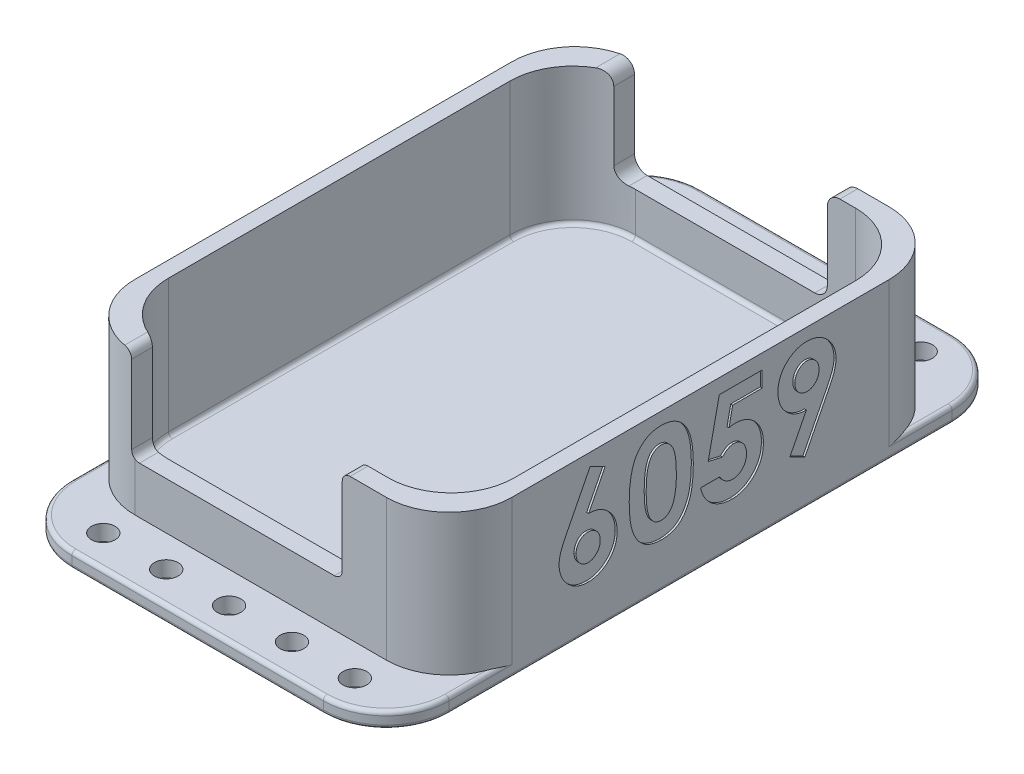
from build123d import *

# Parameters (mm, degrees)
SKETCH1_W                      = 76.2
SKETCH1_H                      = 101.6
BOSS_EXTRUDE1_DEPTH            = 0.79375
SKETCH2_W                      = 76.2
SKETCH2_H                      = 101.6
SKETCH2_W_2                    = 69.85
SKETCH2_H_2                    = 94.361
BOSS_EXTRUDE2_DEPTH            = 27.178
FILLET1_R                      = 12.7
SKETCH3_W                      = 42.545
SKETCH3_H                      = 18.44675
CUT_EXTRUDE1_DEPTH             = 113.056185898
BOSS_EXTRUDE3_START            = 0.508
BOSS_EXTRUDE3_DEPTH            = 0.508
FILLET2_R                      = 1.5875
SKETCH5_W                      = 76.2
SKETCH5_H                      = 127
BOSS_EXTRUDE4_DEPTH            = 3.175
FILLET3_R                      = 12.7
F_3_16_0_1875_DIAMETER_HOLE1_D = 4.7625
FILLET4_R                      = 0.79375
FILLET5_R                      = 0.79375
CUT_EXTRUDE2_DEPTH             = 0.396875
CUT_EXTRUDE3_DEPTH             = 0.396875
FILLET7_R                      = 0.79375
FILLET8_R                      = 2.54


with BuildPart() as part:
    # Sketch1 → Boss-Extrude1 (new body)
    with BuildSketch(Plane(origin=(0, 0, 0), x_dir=(1, 0, 0), z_dir=(0, 1, 0))):
        Rectangle(SKETCH1_W, SKETCH1_H)
    extrude(amount=BOSS_EXTRUDE1_DEPTH)

    # Sketch2 → Boss-Extrude2 (add)
    with BuildSketch(Plane(origin=(0, 0.79375, 0), x_dir=(1, 0, 0), z_dir=(0, 1, 0))):
        Rectangle(SKETCH2_W, SKETCH2_H)
        Rectangle(SKETCH2_W_2, SKETCH2_H_2, mode=Mode.SUBTRACT)
    extrude(amount=BOSS_EXTRUDE2_DEPTH)

    # Fillet1
    fillet1_edges = [part.edges().sort_by_distance(p)[0] for p in [
        (34.925, 14.38275, -47.1805),
        (-34.925, 14.38275, -47.1805),
        (-34.925, 14.38275, 47.1805),
        (34.925, 14.38275, 47.1805),
        (38.1, 13.985875, 50.8),
        (-38.1, 13.985875, 50.8),
        (-38.1, 13.985875, -50.8),
        (38.1, 13.985875, -50.8),
    ]]
    fillet(fillet1_edges, radius=FILLET1_R)

    # Sketch3 → Cut-Extrude1 (cut, through all)
    with BuildSketch(Plane.XY.offset(50.8)):
        with Locations((-4.7625, 18.748375)):
            Rectangle(SKETCH3_W, SKETCH3_H)
    extrude(amount=-CUT_EXTRUDE1_DEPTH, mode=Mode.SUBTRACT)

    # Sketch4 → Boss-Extrude3 (add)
    with BuildSketch(Plane(origin=(0, 27.97175, 0), x_dir=(1, 0, 0), z_dir=(0, 1, 0)).offset(BOSS_EXTRUDE3_START)):
        with BuildLine():
            Line((16.51, -47.1805), (16.51, -50.8))
            Line((16.51, -50.8), (25.4, -50.8))
            ThreePointArc((25.4, -50.8), (34.380256121, -47.080256121), (38.1, -38.1))
            Line((38.1, -38.1), (38.1, 38.1))
            ThreePointArc((38.1, 38.1), (34.380256121, 47.080256121), (25.4, 50.8))
            Line((25.4, 50.8), (16.51, 50.8))
            Line((16.51, 50.8), (16.51, 47.1805))
            Line((16.51, 47.1805), (22.225, 47.1805))
            ThreePointArc((22.225, 47.1805), (31.205256121, 43.460756121), (34.925, 34.4805))
            Line((34.925, 34.4805), (34.925, -34.4805))
            ThreePointArc((34.925, -34.4805), (31.205256121, -43.460756121), (22.225, -47.1805))
            Line((22.225, -47.1805), (16.51, -47.1805))
        make_face()
        with BuildLine():
            ThreePointArc((-38.1, -38.1), (-34.602024234, -46.852870958), (-26.035, -50.784115066))
            Line((-26.035, -50.784115066), (-26.035, -46.595527858))
            ThreePointArc((-26.035, -46.595527858), (-32.46406734, -41.993921325), (-34.925, -34.4805))
            Line((-34.925, -34.4805), (-34.925, 34.4805))
            ThreePointArc((-34.925, 34.4805), (-32.46406734, 41.993921325), (-26.035, 46.595527858))
            Line((-26.035, 46.595527858), (-26.035, 50.784115066))
            ThreePointArc((-26.035, 50.784115066), (-34.602024234, 46.852870958), (-38.1, 38.1))
            Line((-38.1, 38.1), (-38.1, -38.1))
        make_face()
    extrude(amount=-BOSS_EXTRUDE3_DEPTH)

    # Fillet2
    fillet2_edges = [part.edges().sort_by_distance(p)[0] for p in [
        (16.51, 28.47975, 48.99025),
        (16.51, 9.525, 48.99025),
        (-26.035, 9.525, 48.689821462),
        (-26.035, 28.47975, 48.689821462),
    ]]
    fillet(fillet2_edges, radius=FILLET2_R)

    # Sketch5 → Boss-Extrude4 (add)
    with BuildSketch(Plane.XZ):
        Rectangle(SKETCH5_W, SKETCH5_H)
    extrude(amount=BOSS_EXTRUDE4_DEPTH)

    # Fillet3
    fillet3_edges = [part.edges().sort_by_distance(p)[0] for p in [
        (-38.1, -1.5875, 63.5),
        (-38.1, -1.5875, -63.5),
        (38.1, -1.5875, -63.5),
        (38.1, -1.5875, 63.5),
    ]]
    fillet(fillet3_edges, radius=FILLET3_R)

    # 3/16 (0.1875) Diameter Hole1 (through all)
    with Locations(Plane(origin=(-25.4, 0, 57.15), x_dir=(0, 0, 1), z_dir=(0, 1, 0))):
        with Locations((0, 0), (0, 12.7), (0, 25.4), (0, 38.1), (0, 50.8), (-114.3, 50.8), (-114.3, 38.1), (-114.3, 25.4), (-114.3, 12.7), (-114.3, 0)):
            Hole(F_3_16_0_1875_DIAMETER_HOLE1_D / 2)

    # Fillet4
    fillet4_edges = [part.edges().sort_by_distance(p)[0] for p in [
        (-38.1, 0, -44.45),
        (0, 0, -63.5),
        (38.1, 0, -44.45),
        (34.380256121, 0, -59.780256121),
        (-34.380256121, 0, -59.780256121),
    ]]
    fillet(fillet4_edges, radius=FILLET4_R)

    # Fillet5
    fillet5_edges = [part.edges().sort_by_distance(p)[0] for p in [
        (38.1, 0, 44.45),
        (0, -3.175, -63.5),
        (-38.1, -3.175, 0),
        (-38.1, 0, 44.45),
        (38.1, -3.175, 0),
        (0, -3.175, 63.5),
        (-34.380256121, -3.175, 59.780256121),
        (34.380256121, -3.175, 59.780256121),
        (34.380256121, -3.175, -59.780256121),
        (-34.380256121, -3.175, -59.780256121),
        (0, 0, 63.5),
        (-34.380256121, 0, 59.780256121),
        (34.380256121, 0, 59.780256121),
    ]]
    fillet(fillet5_edges, radius=FILLET5_R)

    # Sketch9 → Cut-Extrude2 (cut)
    # profile 1 of 4: a face of its own
    with BuildSketch(Plane.ZY.offset(38.1)):
        with BuildLine():
            Line((-21.67815406, 26.514268643), (-18.651982185, 24.980194124))
            Line((-18.651982185, 24.980194124), (-21.971994204, 18.454653258))
            add(Edge.make_bspline(
                [(-21.971994204, 18.454653258), (-21.775851009, 18.449575012), (-21.389514821, 18.439572574), (-20.821099511, 18.358731191), (-20.277683894, 18.218975825), (-19.753788733, 18.033730465), (-19.255818152, 17.784944107), (-18.775752056, 17.488999756), (-18.326009998, 17.128063787), (-17.896279778, 16.728165883), (-17.505528296, 16.285136477), (-17.166091552, 15.809087307), (-16.870278422, 15.311600707), (-16.640325199, 14.781546695), (-16.454837273, 14.22771152), (-16.320999571, 13.647881262), (-16.244641417, 13.040376863), (-16.234114172, 12.627671605), (-16.228755021, 12.417573932)],
                knots=[0, 0, 0, 0, 1.013260694, 1.995783107, 2.958651975, 3.908806537, 4.861209129, 5.829647963, 6.817170299, 7.835534541, 8.860094905, 9.863329007, 10.853101798, 11.844815043, 12.84250023, 13.867713965, 14.914507806, 16, 16, 16, 16], degree=3))
            add(Edge.make_bspline(
                [(-16.228755021, 12.417573932), (-16.233776989, 12.215052519), (-16.243703266, 11.81475453), (-16.325757085, 11.226818591), (-16.458360367, 10.662728441), (-16.647877085, 10.123610637), (-16.888768161, 9.606829956), (-17.183361629, 9.11268965), (-17.534100571, 8.644882268), (-17.931922863, 8.205893512), (-18.366811257, 7.805752016), (-18.82520731, 7.450082966), (-19.310995415, 7.156286837), (-19.814993607, 6.908169119), (-20.346480801, 6.723019551), (-20.897503265, 6.583263701), (-21.472239563, 6.502618509), (-21.862355836, 6.492477285), (-22.059764637, 6.487345566)],
                knots=[0, 0, 0, 0, 1.049934834, 2.075270938, 3.072134561, 4.05064612, 5.033440221, 6.024524368, 7.028587226, 8.060776465, 9.092543989, 10.090062252, 11.064205434, 12.031961459, 12.998029633, 13.977230324, 14.976426867, 16, 16, 16, 16], degree=3))
            add(Edge.make_bspline(
                [(-22.059764637, 6.487345566), (-22.266194253, 6.491556895), (-22.672110161, 6.499837904), (-23.266066723, 6.592563379), (-23.835722186, 6.732148656), (-24.377874992, 6.931452715), (-24.895896629, 7.185228629), (-25.383688327, 7.499250799), (-25.845359054, 7.8700564), (-26.275986725, 8.289302893), (-26.663950165, 8.748530063), (-27.009981128, 9.225327428), (-27.30272377, 9.720443189), (-27.539692114, 10.233347973), (-27.724580312, 10.762407385), (-27.853224789, 11.308625538), (-27.937048537, 11.870553587), (-27.94687496, 12.25190976), (-27.951831945, 12.444286672)],
                knots=[0, 0, 0, 0, 1.063775006, 2.091769615, 3.092589432, 4.084662827, 5.064601646, 6.061867366, 7.070035304, 8.113879863, 9.156342271, 10.166834137, 11.149076039, 12.117706134, 13.076241869, 14.034148791, 15.008317125, 16, 16, 16, 16], degree=3))
            add(Edge.make_bspline(
                [(-27.951831945, 12.444286672), (-27.949212771, 12.593260086), (-27.943959845, 12.892036161), (-27.891171076, 13.339437097), (-27.810913605, 13.788012419), (-27.717884687, 14.166534479), (-27.622092907, 14.486614495), (-27.525677744, 14.757489563), (-27.406192394, 15.058101659), (-27.269602939, 15.389218425), (-27.111614139, 15.750441528), (-26.933051298, 16.140786368), (-26.733469876, 16.563208929), (-26.591140833, 16.853347819), (-26.516976175, 17.004533066)],
                knots=[0, 0, 0, 0, 1.110454016, 2.227089276, 3.35462975, 4.507227546, 5.131400587, 5.845402449, 6.650387134, 7.543487832, 8.516250726, 9.590168902, 10.744287919, 12, 12, 12, 12], degree=3))
            Line((-26.516976175, 17.004533066), (-21.67815406, 26.514268643))
        make_face()
        with BuildLine():
            add(Edge.make_bspline(
                [(-22.136086752, 15.279653258), (-22.300151851, 15.272127939), (-22.621205714, 15.257401877), (-23.077696292, 15.103183383), (-23.493912129, 14.86125295), (-23.854693164, 14.524318033), (-24.156453303, 14.121667577), (-24.37819724, 13.662390949), (-24.511588543, 13.152617068), (-24.525447045, 12.79619167), (-24.532601175, 12.612195326)],
                knots=[0, 0, 0, 0, 0.981744412, 1.921144944, 2.858899012, 3.85339082, 4.86292663, 5.863643845, 6.897155691, 8, 8, 8, 8], degree=3))
            add(Edge.make_bspline(
                [(-24.532601175, 12.612195326), (-24.524130461, 12.42813771), (-24.507654356, 12.070133345), (-24.369247366, 11.555505507), (-24.142632178, 11.085799239), (-23.824818827, 10.67781279), (-23.451710521, 10.33915245), (-23.037977664, 10.088696935), (-22.590521469, 9.934833894), (-22.281005091, 9.916060561), (-22.124638435, 9.906576335)],
                knots=[0, 0, 0, 0, 1.098279937, 2.136227893, 3.159405121, 4.194678092, 5.206500211, 6.154139736, 7.067477469, 8, 8, 8, 8], degree=3))
            add(Edge.make_bspline(
                [(-22.124638435, 9.906576335), (-21.959497573, 9.916229482), (-21.635627661, 9.935160979), (-21.168424071, 10.082549745), (-20.741630789, 10.328809309), (-20.364262972, 10.666385399), (-20.040111188, 11.069716174), (-19.815830896, 11.542181431), (-19.671025289, 12.060523669), (-19.655837812, 12.4241818), (-19.647985791, 12.612195326)],
                knots=[0, 0, 0, 0, 0.96921794, 1.900804717, 2.848419905, 3.844199796, 4.861108892, 5.867439427, 6.897452859, 8, 8, 8, 8], degree=3))
            add(Edge.make_bspline(
                [(-19.647985791, 12.612195326), (-19.656930677, 12.796084237), (-19.674253493, 13.152206585), (-19.804368371, 13.664368639), (-20.0366797, 14.121875045), (-20.345267406, 14.525980111), (-20.718464609, 14.862764787), (-21.151338252, 15.105091322), (-21.628682081, 15.257128652), (-21.964485864, 15.272035586), (-22.136086752, 15.279653258)],
                knots=[0, 0, 0, 0, 1.083229974, 2.097801324, 3.086792542, 4.086858909, 5.079819718, 6.026392613, 6.991456328, 8, 8, 8, 8], degree=3))
        make_face(mode=Mode.SUBTRACT)
    # profile 2 of 4: a face of its own
    with BuildSketch(Plane.ZY.offset(38.1)):
        with BuildLine():
            add(Edge.make_bspline(
                [(-7.371573531, 26.514268643), (-7.20606857, 26.511811675), (-6.880641598, 26.50698062), (-6.401348924, 26.454656358), (-5.939657563, 26.375608991), (-5.493761321, 26.265365478), (-5.066869805, 26.119462115), (-4.655876008, 25.944818291), (-4.265671948, 25.732273577), (-3.891281276, 25.492193407), (-3.532848207, 25.22038862), (-3.198987429, 24.910517128), (-2.883601935, 24.569709088), (-2.59351866, 24.192812094), (-2.322313621, 23.783254422), (-2.070877952, 23.340971131), (-1.841136456, 22.86379754), (-1.630514278, 22.350872552), (-1.442175262, 21.794507641), (-1.283537542, 21.188321061), (-1.147479152, 20.53217438), (-1.032636271, 19.824434349), (-0.945833615, 19.064160211), (-0.887326877, 18.251857056), (-0.847176784, 17.389090884), (-0.843900014, 16.797240379), (-0.84221656, 16.493174893)],
                knots=[0, 0, 0, 0, 0.879237366, 1.728815576, 2.559023295, 3.367336655, 4.166867292, 4.954216142, 5.737608147, 6.525189134, 7.316157332, 8.124696809, 8.942788509, 9.781158001, 10.649253743, 11.551476218, 12.482711956, 13.461909668, 14.496590415, 15.601789533, 16.789733467, 18.056700938, 19.410929216, 20.8549011, 22.384193279, 24, 24, 24, 24], degree=3))
            add(Edge.make_bspline(
                [(-0.84221656, 16.493174893), (-0.844035918, 16.185305206), (-0.847570899, 15.587119928), (-0.885657826, 14.716462458), (-0.951245313, 13.898261494), (-1.035779201, 13.132601685), (-1.151567503, 12.419887362), (-1.2871717, 11.758273076), (-1.448313468, 11.147998645), (-1.642856311, 10.590439148), (-1.852203588, 10.07661335), (-2.082573526, 9.600370134), (-2.329950809, 9.160419569), (-2.588661349, 8.750124403), (-2.872888608, 8.381579928), (-3.168798445, 8.042253705), (-3.489275303, 7.745071106), (-3.820825866, 7.474716672), (-4.175596174, 7.241076187), (-4.549927572, 7.03673807), (-4.950493741, 6.870995589), (-5.369993039, 6.726841631), (-5.815575919, 6.623354643), (-6.280162128, 6.541241119), (-6.768996751, 6.495860149), (-7.101815052, 6.490230341), (-7.272354781, 6.487345566)],
                knots=[0, 0, 0, 0, 1.643780988, 3.193836972, 4.651895693, 6.025988579, 7.305620092, 8.505800249, 9.631074763, 10.672816429, 11.65661981, 12.592235626, 13.49536222, 14.350718032, 15.179365177, 15.97804903, 16.751647189, 17.51006938, 18.259804725, 19.016521909, 19.783502495, 20.571750527, 21.382245291, 22.22305063, 23.089471752, 24, 24, 24, 24], degree=3))
            add(Edge.make_bspline(
                [(-7.272354781, 6.487345566), (-7.442889907, 6.490285987), (-7.776965711, 6.496046227), (-8.267122192, 6.540903692), (-8.734170475, 6.623687286), (-9.183278631, 6.727636127), (-9.611320938, 6.870676634), (-10.020349846, 7.041378012), (-10.407220277, 7.24444116), (-10.773003415, 7.478626006), (-11.116450371, 7.747171564), (-11.442898309, 8.047205437), (-11.751625108, 8.377967119), (-12.037934266, 8.743161412), (-12.306514701, 9.137913735), (-12.554565542, 9.566731968), (-12.781937718, 10.028991761), (-12.995743472, 10.525337456), (-13.181513608, 11.066454808), (-13.346840404, 11.657175926), (-13.482271766, 12.302424957), (-13.59119473, 13.001994609), (-13.678158762, 13.754402812), (-13.742850006, 14.560012733), (-13.781148489, 15.419199604), (-13.784646398, 16.009761539), (-13.786447329, 16.313817922)],
                knots=[0, 0, 0, 0, 0.917216111, 1.796812873, 2.643793957, 3.46689424, 4.273913431, 5.068098542, 5.848489301, 6.620921603, 7.401012384, 8.190319798, 9.003608147, 9.831726257, 10.68377682, 11.569763213, 12.493818149, 13.453288342, 14.474581811, 15.568529029, 16.750744269, 18.018426408, 19.375425659, 20.823733699, 22.36466933, 24, 24, 24, 24], degree=3))
            add(Edge.make_bspline(
                [(-13.786447329, 16.313817922), (-13.78318511, 16.73628033), (-13.776890616, 17.551426989), (-13.697122168, 18.729076907), (-13.580042319, 19.817610258), (-13.408079753, 20.815206193), (-13.195450419, 21.725559517), (-12.923167485, 22.542673299), (-12.613193171, 23.27785414), (-12.349055233, 23.713379697), (-12.221843964, 23.923132826)],
                knots=[0, 0, 0, 0, 1.288568992, 2.486310467, 3.599230591, 4.627010532, 5.572937695, 6.447898582, 7.252493626, 8, 8, 8, 8], degree=3))
            add(Edge.make_bspline(
                [(-12.221843964, 23.923132826), (-12.073928759, 24.129194234), (-11.784725386, 24.532084893), (-11.279045206, 25.061005017), (-10.73575769, 25.513363407), (-10.143704024, 25.878922788), (-9.512247783, 26.167202945), (-8.835967593, 26.370811974), (-8.117360844, 26.489444081), (-7.623881603, 26.50587022), (-7.371573531, 26.514268643)],
                knots=[0, 0, 0, 0, 1.058512271, 2.069600068, 3.047294572, 4.004278952, 4.967380941, 5.939006123, 6.946246673, 8, 8, 8, 8], degree=3))
        make_face()
        with BuildLine():
            add(Edge.make_bspline(
                [(-7.287619204, 23.095037874), (-7.437237061, 23.087946285), (-7.730567483, 23.074043006), (-8.1562039, 22.956023785), (-8.557552467, 22.773736734), (-8.862847602, 22.554382769), (-9.091357974, 22.344105688), (-9.25101981, 22.153811768), (-9.404988486, 21.941457469), (-9.540981374, 21.697460331), (-9.66939416, 21.430587462), (-9.794892158, 21.139627417), (-9.897767563, 20.817433588), (-9.99883992, 20.469492979), (-10.087388736, 20.086185955), (-10.161573232, 19.664379405), (-10.227850558, 19.201330282), (-10.274079783, 18.696735287), (-10.317179294, 18.151122352), (-10.348075065, 17.563276063), (-10.360991811, 16.933355009), (-10.365097651, 16.499537726), (-10.36721656, 16.275656864)],
                knots=[0, 0, 0, 0, 1.076674018, 2.110852608, 3.161083442, 4.239746716, 4.804137807, 5.395870207, 6.026861976, 6.692161227, 7.405688833, 8.16177676, 8.973626916, 9.841385931, 10.773283133, 11.807421078, 12.927755683, 14.143907515, 15.458935494, 16.872852025, 18.386167141, 20, 20, 20, 20], degree=3))
            add(Edge.make_bspline(
                [(-10.36721656, 16.275656864), (-10.363729094, 15.985608384), (-10.357041618, 15.429418919), (-10.322015749, 14.629599101), (-10.2518093, 13.901698664), (-10.164486653, 13.240784356), (-10.041838429, 12.651142384), (-9.900723708, 12.127194187), (-9.726459575, 11.675618833), (-9.525063792, 11.289885528), (-9.302008888, 10.961743006), (-9.059872977, 10.682820384), (-8.806899919, 10.441286553), (-8.535193604, 10.245091599), (-8.24540224, 10.09473683), (-7.939945054, 9.986588501), (-7.61862793, 9.920386406), (-7.398593276, 9.911206303), (-7.287619204, 9.906576335)],
                knots=[0, 0, 0, 0, 1.771748488, 3.397459088, 4.888034009, 6.237357457, 7.467047327, 8.564189669, 9.548206622, 10.417051504, 11.216568818, 11.965764335, 12.669334354, 13.348544111, 14.005342236, 14.656555988, 15.322436492, 16, 16, 16, 16], degree=3))
            add(Edge.make_bspline(
                [(-7.287619204, 9.906576335), (-7.180453411, 9.909744503), (-6.970636113, 9.915947382), (-6.664675502, 9.979619099), (-6.375337408, 10.083135482), (-6.103495433, 10.229566673), (-5.848177236, 10.415776336), (-5.610630654, 10.642582757), (-5.392647217, 10.912246667), (-5.265649076, 11.112377169), (-5.200209348, 11.215500614)],
                knots=[0, 0, 0, 0, 0.992283464, 1.942767638, 2.88273346, 3.832339453, 4.79467288, 5.803907806, 6.868395428, 8, 8, 8, 8], degree=3))
            add(Edge.make_bspline(
                [(-5.200209348, 11.215500614), (-5.12316509, 11.356415506), (-4.961609528, 11.651902605), (-4.774657152, 12.150526068), (-4.617291062, 12.712890922), (-4.48184837, 13.340747302), (-4.389213831, 14.03657155), (-4.309437079, 14.795951384), (-4.270958769, 15.622710733), (-4.264700062, 16.195492593), (-4.261447329, 16.493174893)],
                knots=[0, 0, 0, 0, 0.710965849, 1.490837728, 2.352621235, 3.297892224, 4.334225155, 5.461620853, 6.680770821, 8, 8, 8, 8], degree=3))
            add(Edge.make_bspline(
                [(-4.261447329, 16.493174893), (-4.26270379, 16.793441219), (-4.265122261, 17.371402639), (-4.309494212, 18.201134246), (-4.371285544, 18.958956364), (-4.461668425, 19.643177082), (-4.577962429, 20.25545739), (-4.721295227, 20.795757262), (-4.890273935, 21.265141525), (-5.090662544, 21.663142139), (-5.312605379, 22.001388063), (-5.548204474, 22.29157683), (-5.798456037, 22.539332678), (-6.062941567, 22.745587956), (-6.347782673, 22.903182457), (-6.647538519, 23.014457212), (-6.962823627, 23.081774707), (-7.177892706, 23.090557145), (-7.287619204, 23.095037874)],
                knots=[0, 0, 0, 0, 1.793836731, 3.452829483, 4.963243077, 6.335886805, 7.574563692, 8.684454726, 9.672768357, 10.54971625, 11.340229787, 12.085688095, 12.778991901, 13.440269426, 14.083255152, 14.715733572, 15.344777694, 16, 16, 16, 16], degree=3))
        make_face(mode=Mode.SUBTRACT)
    # profile 3 of 4: a face of its own
    with BuildSketch(Plane.ZY.offset(38.1)):
        with BuildLine():
            Line((4.404928873, 26.025807105), (13.078937286, 26.025807105))
            Line((13.078937286, 26.025807105), (13.078937286, 22.850807105))
            Line((13.078937286, 22.850807105), (7.114363969, 22.850807105))
            Line((7.114363969, 22.850807105), (6.370223344, 19.248403258))
            add(Edge.make_bspline(
                [(6.370223344, 19.248403258), (6.471623156, 19.276644386), (6.67160442, 19.332341693), (6.972876441, 19.388199044), (7.264851015, 19.424404004), (7.456442949, 19.429233263), (7.549400027, 19.431576335)],
                knots=[0, 0, 0, 0, 1.05461699, 2.079921384, 3.068411212, 4, 4, 4, 4], degree=3))
            add(Edge.make_bspline(
                [(7.549400027, 19.431576335), (7.751963237, 19.426934717), (8.151259947, 19.417785064), (8.735380365, 19.330925016), (9.294710172, 19.194123071), (9.827537757, 18.999015274), (10.333342618, 18.745077436), (10.812737891, 18.437883836), (11.266311953, 18.076894931), (11.686007419, 17.661884711), (12.071641145, 17.206194092), (12.406927675, 16.713316471), (12.693283295, 16.190279802), (12.921040655, 15.633832902), (13.10080618, 15.047470631), (13.230708763, 14.430817229), (13.30752665, 13.783141872), (13.317885071, 13.341279282), (13.323168055, 13.115921287)],
                knots=[0, 0, 0, 0, 1.01440847, 1.999622559, 2.951875003, 3.895578053, 4.836219714, 5.782137149, 6.743708247, 7.735272588, 8.734977101, 9.730283169, 10.717124674, 11.717316708, 12.737475749, 13.78628267, 14.87096371, 16, 16, 16, 16], degree=3))
            add(Edge.make_bspline(
                [(13.323168055, 13.115921287), (13.316712164, 12.888004957), (13.303972803, 12.438259415), (13.220860147, 11.776974382), (13.074164816, 11.143612607), (12.872664101, 10.536478596), (12.607199808, 9.96003464), (12.287942663, 9.408309208), (11.90949489, 8.885397582), (11.475570357, 8.396660242), (11.00383747, 7.94994493), (10.501553301, 7.556968615), (9.972246549, 7.226282229), (9.415904442, 6.959031722), (8.83571889, 6.747587879), (8.231513802, 6.593666854), (7.600352818, 6.505401698), (7.171876518, 6.493430415), (6.954087527, 6.487345566)],
                knots=[0, 0, 0, 0, 1.06808661, 2.107647099, 3.116961351, 4.110378221, 5.100014249, 6.085620622, 7.093190682, 8.119403071, 9.144090782, 10.133780668, 11.103064255, 12.062861538, 13.020824475, 13.992378307, 14.979551724, 16, 16, 16, 16], degree=3))
            add(Edge.make_bspline(
                [(6.954087527, 6.487345566), (6.759325315, 6.492323352), (6.375213475, 6.502140586), (5.809433598, 6.562482481), (5.263958967, 6.669167517), (4.741685459, 6.823568389), (4.237117881, 7.013600614), (3.756089179, 7.251271824), (3.295956018, 7.532056438), (2.858025001, 7.850830132), (2.449411887, 8.209916334), (2.076473133, 8.602998051), (1.736950922, 9.02512068), (1.438110497, 9.481491931), (1.180888632, 9.971437541), (0.952779035, 10.489183389), (0.766069045, 11.040136392), (0.671319103, 11.422087625), (0.623168055, 11.61619172)],
                knots=[0, 0, 0, 0, 1.054957082, 2.080596141, 3.077793124, 4.061112343, 5.027190972, 5.994718051, 6.962465889, 7.943658696, 8.924948258, 9.904494768, 10.875059, 11.855380583, 12.854004648, 13.869083016, 14.917087635, 16, 16, 16, 16], degree=3))
            Line((0.623168055, 11.61619172), (4.530860363, 11.61619172))
            add(Edge.make_bspline(
                [(4.530860363, 11.61619172), (4.602293073, 11.481685486), (4.741114392, 11.220287971), (5.005183232, 10.873243493), (5.300791534, 10.577298872), (5.625272749, 10.329562664), (5.980729315, 10.143962913), (6.352677047, 10.003212648), (6.745788568, 9.921878283), (7.01351487, 9.911710681), (7.148708921, 9.906576335)],
                knots=[0, 0, 0, 0, 1.104910296, 2.147267069, 3.153527244, 4.136738762, 5.099945312, 6.05603338, 7.018353, 8, 8, 8, 8], degree=3))
            add(Edge.make_bspline(
                [(7.148708921, 9.906576335), (7.24293736, 9.910121646), (7.428333403, 9.917097103), (7.701485155, 9.953999025), (7.962220503, 10.023890428), (8.212477951, 10.120673773), (8.452929756, 10.241373536), (8.680128957, 10.393749123), (8.89802841, 10.569139073), (9.103310803, 10.770399634), (9.289237481, 10.994758345), (9.45227484, 11.235847075), (9.598052722, 11.48830878), (9.706032628, 11.762144102), (9.79445904, 12.049176221), (9.859579827, 12.351570308), (9.898496842, 12.669679536), (9.902099516, 12.886843787), (9.903937286, 12.997622008)],
                knots=[0, 0, 0, 0, 0.978869489, 1.925942215, 2.855067702, 3.774946051, 4.70828698, 5.642468714, 6.60995405, 7.609372294, 8.622401667, 9.629904756, 10.629323, 11.642352373, 12.678539694, 13.745912462, 14.850161547, 16, 16, 16, 16], degree=3))
            add(Edge.make_bspline(
                [(9.903937286, 12.997622008), (9.901804342, 13.105828816), (9.897652514, 13.316455993), (9.863307766, 13.625732135), (9.801865672, 13.919179221), (9.718150292, 14.199044839), (9.610984612, 14.463629508), (9.480020986, 14.714508164), (9.324699927, 14.950412707), (9.144187546, 15.166540352), (8.951691001, 15.364778774), (8.744887858, 15.538156519), (8.525641301, 15.682048009), (8.300764149, 15.807669467), (8.061280114, 15.899094025), (7.812574231, 15.962054746), (7.554908047, 16.00825279), (7.379159534, 16.010967094), (7.289904834, 16.012345566)],
                knots=[0, 0, 0, 0, 1.166249705, 2.270133367, 3.348514167, 4.393962215, 5.415026464, 6.420877785, 7.440098956, 8.453121383, 9.451844239, 10.415694839, 11.355045125, 12.27538808, 13.187007209, 14.108269027, 15.039275622, 16, 16, 16, 16], degree=3))
            add(Edge.make_bspline(
                [(7.289904834, 16.012345566), (7.192953486, 16.008666801), (6.998642185, 16.001293766), (6.709944224, 15.941301355), (6.424727158, 15.844211129), (6.141404887, 15.710259774), (5.862789876, 15.534959717), (5.581529336, 15.329352848), (5.307037662, 15.078499878), (5.13250822, 14.891664016), (5.042218536, 14.795007826)],
                knots=[0, 0, 0, 0, 0.88288272, 1.769486374, 2.674910571, 3.623812639, 4.617874466, 5.670434592, 6.794841017, 8, 8, 8, 8], degree=3))
            Line((5.042218536, 14.795007826), (2.164874786, 15.455194124))
            Line((2.164874786, 15.455194124), (4.404928873, 26.025807105))
        make_face()
    # profile 4 of 4: a face of its own
    with BuildSketch(Plane.ZY.offset(38.1)):
        with BuildLine():
            Line((21.703336325, 6.487345566), (18.673348344, 8.013787874))
            Line((18.673348344, 8.013787874), (21.993360363, 14.546960951))
            add(Edge.make_bspline(
                [(21.993360363, 14.546960951), (21.797206432, 14.551960654), (21.412108806, 14.56177628), (20.845082594, 14.643344048), (20.302849079, 14.782585434), (19.779017115, 14.967950796), (19.28083113, 15.216452271), (18.802250223, 15.513025741), (18.34989957, 15.869354502), (17.92165829, 16.269882763), (17.530660314, 16.712596139), (17.191282342, 17.188726881), (16.895475403, 17.686196949), (16.665439703, 18.216237089), (16.480673857, 18.768968669), (16.345674614, 19.34725269), (16.26991661, 19.953626289), (16.259327785, 20.366317529), (16.253937286, 20.576408066)],
                knots=[0, 0, 0, 0, 1.014336294, 1.991387562, 2.955278539, 3.906441712, 4.859855302, 5.829322156, 6.813833455, 7.833278715, 8.858926674, 9.863225732, 10.85404919, 11.846815163, 12.845559416, 13.865450493, 14.913355531, 16, 16, 16, 16], degree=3))
            add(Edge.make_bspline(
                [(16.253937286, 20.576408066), (16.258937268, 20.780193817), (16.268789629, 21.181749424), (16.350614437, 21.771102376), (16.485276894, 22.336967312), (16.67002896, 22.8792481), (16.915980976, 23.394288047), (17.20386155, 23.890151483), (17.555782489, 24.356579528), (17.953333428, 24.795591351), (18.388431832, 25.197209654), (18.850034715, 25.550330289), (19.336043237, 25.84550521), (19.840211707, 26.093397689), (20.371653336, 26.278607529), (20.922688197, 26.41834698), (21.497421136, 26.498996615), (21.887537868, 26.509137232), (22.084946902, 26.514268643)],
                knots=[0, 0, 0, 0, 1.055538678, 2.079917126, 3.075849687, 4.065898488, 5.041806164, 6.028602842, 7.031727914, 8.062953097, 9.093756959, 10.095582084, 11.068815425, 12.035667573, 13.000833448, 13.979119574, 14.977382875, 16, 16, 16, 16], degree=3))
            add(Edge.make_bspline(
                [(22.084946902, 26.514268643), (22.291361926, 26.510019813), (22.697249142, 26.501665064), (23.291413522, 26.409473698), (23.85988595, 26.26803528), (24.404976223, 26.075933054), (24.919917274, 25.815210571), (25.409017866, 25.502732861), (25.870651094, 25.131586146), (26.299859357, 24.712468028), (26.690219476, 24.256598657), (27.03622515, 23.7794134), (27.326884606, 23.281845291), (27.564952479, 22.768334953), (27.750406155, 22.238077911), (27.877881921, 21.690322017), (27.962511692, 21.126003957), (27.972140871, 20.743354608), (27.977014209, 20.549695326)],
                knots=[0, 0, 0, 0, 1.062826075, 2.08990367, 3.089830715, 4.078784409, 5.060762809, 6.057138927, 7.064407536, 8.107320944, 9.143871033, 10.153461498, 11.140480137, 12.108246174, 13.065926856, 14.029354859, 15.002654194, 16, 16, 16, 16], degree=3))
            add(Edge.make_bspline(
                [(27.977014209, 20.549695326), (27.974354783, 20.40199599), (27.968998101, 20.104496319), (27.91632713, 19.658363314), (27.836414655, 19.210993807), (27.743659313, 18.834867009), (27.64641824, 18.517814963), (27.551791602, 18.248855101), (27.430382839, 17.950259155), (27.294817821, 17.620025704), (27.137817575, 17.259602863), (26.956126989, 16.87071359), (26.760726945, 16.447590269), (26.616697824, 16.15826431), (26.54215844, 16.00852946)],
                knots=[0, 0, 0, 0, 1.105131805, 2.225983929, 3.357782449, 4.505488967, 5.122909461, 5.839607681, 6.638776516, 7.535249922, 8.51168636, 9.581005249, 10.748097757, 12, 12, 12, 12], degree=3))
            Line((26.54215844, 16.00852946), (21.703336325, 6.487345566))
        make_face()
        with BuildLine():
            add(Edge.make_bspline(
                [(22.161269017, 17.721960951), (22.32510431, 17.731606409), (22.645201377, 17.750451451), (23.104999526, 17.896165331), (23.516495492, 18.145521352), (23.881219305, 18.476794146), (24.1826159, 18.880962109), (24.401750947, 19.341071409), (24.536731391, 19.847593688), (24.550631295, 20.200301932), (24.55778344, 20.381786672)],
                knots=[0, 0, 0, 0, 0.984774978, 1.924027336, 2.867853169, 3.859505234, 4.871392407, 5.881338128, 6.909850265, 8, 8, 8, 8], degree=3))
            add(Edge.make_bspline(
                [(24.55778344, 20.381786672), (24.549169461, 20.567046713), (24.532413215, 20.927421726), (24.396139713, 21.44610248), (24.16327571, 21.914959119), (23.846477552, 22.322524657), (23.476619835, 22.663604945), (23.063025549, 22.91275491), (22.615737624, 23.066821263), (22.30619873, 23.085567392), (22.1498207, 23.095037874)],
                knots=[0, 0, 0, 0, 1.104110315, 2.147758178, 3.172670271, 4.206310416, 5.210906102, 6.157051016, 7.068948237, 8, 8, 8, 8], degree=3))
            add(Edge.make_bspline(
                [(22.1498207, 23.095037874), (21.984537899, 23.085805376), (21.660006472, 23.067677441), (21.194497437, 22.913981067), (20.765371183, 22.669615611), (20.390624976, 22.327378054), (20.066296504, 21.925180022), (19.840133407, 21.454740783), (19.69705479, 20.939679586), (19.681273466, 20.578658306), (19.673168055, 20.393234989)],
                knots=[0, 0, 0, 0, 0.970967322, 1.90648639, 2.855811969, 3.858352357, 4.877096915, 5.878517833, 6.91039038, 8, 8, 8, 8], degree=3))
            add(Edge.make_bspline(
                [(19.673168055, 20.393234989), (19.681634658, 20.210454745), (19.698101316, 19.854966257), (19.836108654, 19.345571291), (20.06090878, 18.883027055), (20.368226588, 18.475671653), (20.746766448, 18.142766641), (21.176569316, 17.896066765), (21.656004472, 17.750056348), (21.989815725, 17.731494666), (22.161269017, 17.721960951)],
                knots=[0, 0, 0, 0, 1.075706617, 2.092137047, 3.084482865, 4.090466434, 5.0784141, 6.035155512, 6.990809768, 8, 8, 8, 8], degree=3))
        make_face(mode=Mode.SUBTRACT)
    extrude(amount=-CUT_EXTRUDE2_DEPTH, mode=Mode.SUBTRACT)

    # Sketch10 → Cut-Extrude3 (cut)
    # profile 1 of 4: a face of its own
    with BuildSketch(Plane(origin=(38.1, 0, 0), x_dir=(0, 0, -1), z_dir=(1, 0, 0))):
        with BuildLine():
            Line((-22.315118815, 25.975854359), (-19.28894694, 24.44177984))
            Line((-19.28894694, 24.44177984), (-22.608958959, 17.916238975))
            add(Edge.make_bspline(
                [(-22.608958959, 17.916238975), (-22.412815765, 17.911160728), (-22.026479576, 17.90115829), (-21.458064266, 17.820316907), (-20.914648649, 17.680561541), (-20.390753489, 17.495316182), (-19.892782907, 17.246529824), (-19.412716811, 16.950585472), (-18.962974753, 16.589649503), (-18.533244533, 16.189751599), (-18.142493051, 15.746722193), (-17.803056307, 15.270673023), (-17.507243177, 14.773186424), (-17.277289955, 14.243132412), (-17.091802028, 13.689297236), (-16.957964326, 13.109466978), (-16.881606173, 12.501962579), (-16.871078928, 12.089257321), (-16.865719777, 11.879159648)],
                knots=[0, 0, 0, 0, 1.013260694, 1.995783107, 2.958651975, 3.908806537, 4.861209129, 5.829647963, 6.817170299, 7.835534541, 8.860094905, 9.863329007, 10.853101798, 11.844815043, 12.84250023, 13.867713965, 14.914507806, 16, 16, 16, 16], degree=3))
            add(Edge.make_bspline(
                [(-16.865719777, 11.879159648), (-16.870741745, 11.676638235), (-16.880668021, 11.276340246), (-16.96272184, 10.688404308), (-17.095325123, 10.124314157), (-17.284841841, 9.585196353), (-17.525732916, 9.068415672), (-17.820326384, 8.574275367), (-18.171065326, 8.106467984), (-18.568887618, 7.667479228), (-19.003776012, 7.267337732), (-19.462172066, 6.911668683), (-19.947960171, 6.617872553), (-20.451958362, 6.369754835), (-20.983445556, 6.184605267), (-21.534468021, 6.044849418), (-22.109204318, 5.964204225), (-22.499320591, 5.954063001), (-22.696729392, 5.948931282)],
                knots=[0, 0, 0, 0, 1.049934834, 2.075270938, 3.072134561, 4.05064612, 5.033440221, 6.024524368, 7.028587226, 8.060776465, 9.092543989, 10.090062252, 11.064205434, 12.031961459, 12.998029633, 13.977230324, 14.976426867, 16, 16, 16, 16], degree=3))
            add(Edge.make_bspline(
                [(-22.696729392, 5.948931282), (-22.903159008, 5.953142611), (-23.309074916, 5.96142362), (-23.903031479, 6.054149095), (-24.472686941, 6.193734372), (-25.014839747, 6.393038431), (-25.532861385, 6.646814345), (-26.020653082, 6.960836515), (-26.482323809, 7.331642117), (-26.91295148, 7.750888609), (-27.300914921, 8.210115779), (-27.646945884, 8.686913144), (-27.939688525, 9.182028905), (-28.176656869, 9.694933689), (-28.361545067, 10.223993101), (-28.490189544, 10.770211254), (-28.574013293, 11.332139303), (-28.583839715, 11.713495476), (-28.5887967, 11.905872388)],
                knots=[0, 0, 0, 0, 1.063775006, 2.091769615, 3.092589432, 4.084662827, 5.064601646, 6.061867366, 7.070035304, 8.113879863, 9.156342271, 10.166834137, 11.149076039, 12.117706134, 13.076241869, 14.034148791, 15.008317125, 16, 16, 16, 16], degree=3))
            add(Edge.make_bspline(
                [(-28.5887967, 11.905872388), (-28.586177526, 12.054845802), (-28.5809246, 12.353621877), (-28.528135831, 12.801022813), (-28.44787836, 13.249598135), (-28.354849443, 13.628120196), (-28.259057662, 13.948200211), (-28.162642499, 14.219075279), (-28.043157149, 14.519687375), (-27.906567694, 14.850804141), (-27.748578894, 15.212027244), (-27.570016054, 15.602372084), (-27.370434631, 16.024794646), (-27.228105588, 16.314933536), (-27.153940931, 16.466118782)],
                knots=[0, 0, 0, 0, 1.110454016, 2.227089276, 3.35462975, 4.507227546, 5.131400587, 5.845402449, 6.650387134, 7.543487832, 8.516250726, 9.590168902, 10.744287919, 12, 12, 12, 12], degree=3))
            Line((-27.153940931, 16.466118782), (-22.315118815, 25.975854359))
        make_face()
        with BuildLine():
            add(Edge.make_bspline(
                [(-22.773051508, 14.741238975), (-22.937116606, 14.733713655), (-23.258170469, 14.718987593), (-23.714661048, 14.564769099), (-24.130876884, 14.322838666), (-24.491657919, 13.985903749), (-24.793418058, 13.583253293), (-25.015161996, 13.123976665), (-25.148553298, 12.614202785), (-25.1624118, 12.257777386), (-25.169565931, 12.073781042)],
                knots=[0, 0, 0, 0, 0.981744412, 1.921144944, 2.858899012, 3.85339082, 4.86292663, 5.863643845, 6.897155691, 8, 8, 8, 8], degree=3))
            add(Edge.make_bspline(
                [(-25.169565931, 12.073781042), (-25.161095216, 11.889723426), (-25.144619111, 11.531719061), (-25.006212121, 11.017091223), (-24.779596933, 10.547384956), (-24.461783582, 10.139398506), (-24.088675276, 9.800738166), (-23.67494242, 9.550282651), (-23.227486224, 9.39641961), (-22.917969846, 9.377646277), (-22.76160319, 9.368162052)],
                knots=[0, 0, 0, 0, 1.098279937, 2.136227893, 3.159405121, 4.194678092, 5.206500211, 6.154139736, 7.067477469, 8, 8, 8, 8], degree=3))
            add(Edge.make_bspline(
                [(-22.76160319, 9.368162052), (-22.596462328, 9.377815198), (-22.272592416, 9.396746695), (-21.805388827, 9.544135461), (-21.378595545, 9.790395025), (-21.001227727, 10.127971115), (-20.677075943, 10.53130189), (-20.452795651, 11.003767147), (-20.307990045, 11.522109385), (-20.292802567, 11.885767516), (-20.284950546, 12.073781042)],
                knots=[0, 0, 0, 0, 0.96921794, 1.900804717, 2.848419905, 3.844199796, 4.861108892, 5.867439427, 6.897452859, 8, 8, 8, 8], degree=3))
            add(Edge.make_bspline(
                [(-20.284950546, 12.073781042), (-20.293895432, 12.257669953), (-20.311218248, 12.613792301), (-20.441333126, 13.125954355), (-20.673644455, 13.583460761), (-20.982232161, 13.987565827), (-21.355429364, 14.324350503), (-21.788303007, 14.566677039), (-22.265646837, 14.718714368), (-22.601450619, 14.733621302), (-22.773051508, 14.741238975)],
                knots=[0, 0, 0, 0, 1.083229974, 2.097801324, 3.086792542, 4.086858909, 5.079819718, 6.026392613, 6.991456328, 8, 8, 8, 8], degree=3))
        make_face(mode=Mode.SUBTRACT)
    # profile 2 of 4: a face of its own
    with BuildSketch(Plane(origin=(38.1, 0, 0), x_dir=(0, 0, -1), z_dir=(1, 0, 0))):
        with BuildLine():
            add(Edge.make_bspline(
                [(-8.008538286, 25.975854359), (-7.843033326, 25.973397391), (-7.517606353, 25.968566336), (-7.038313679, 25.916242074), (-6.576622318, 25.837194707), (-6.130726077, 25.726951194), (-5.70383456, 25.581047831), (-5.292840764, 25.406404007), (-4.902636704, 25.193859293), (-4.528246031, 24.953779123), (-4.169812962, 24.681974336), (-3.835952184, 24.372102844), (-3.52056669, 24.031294805), (-3.230483415, 23.65439781), (-2.959278376, 23.244840139), (-2.707842707, 22.802556848), (-2.478101211, 22.325383257), (-2.267479034, 21.812458268), (-2.079140017, 21.256093357), (-1.920502297, 20.649906778), (-1.784443908, 19.993760097), (-1.669601027, 19.286020065), (-1.58279837, 18.525745927), (-1.524291632, 17.713442772), (-1.48414154, 16.8506766), (-1.480864769, 16.258826095), (-1.479181315, 15.954760609)],
                knots=[0, 0, 0, 0, 0.879237366, 1.728815576, 2.559023295, 3.367336655, 4.166867292, 4.954216142, 5.737608147, 6.525189134, 7.316157332, 8.124696809, 8.942788509, 9.781158001, 10.649253743, 11.551476218, 12.482711956, 13.461909668, 14.496590415, 15.601789533, 16.789733467, 18.056700938, 19.410929216, 20.8549011, 22.384193279, 24, 24, 24, 24], degree=3))
            add(Edge.make_bspline(
                [(-1.479181315, 15.954760609), (-1.481000674, 15.646890923), (-1.484535655, 15.048705644), (-1.522622581, 14.178048174), (-1.588210069, 13.35984721), (-1.672743956, 12.594187401), (-1.788532258, 11.881473079), (-1.924136455, 11.219858793), (-2.085278224, 10.609584362), (-2.279821067, 10.052024864), (-2.489168343, 9.538199066), (-2.719538281, 9.06195585), (-2.966915564, 8.622005285), (-3.225626104, 8.211710119), (-3.509853363, 7.843165644), (-3.8057632, 7.503839421), (-4.126240058, 7.206656822), (-4.457790622, 6.936302388), (-4.812560929, 6.702661903), (-5.186892328, 6.498323787), (-5.587458496, 6.332581305), (-6.006957795, 6.188427347), (-6.452540674, 6.084940359), (-6.917126883, 6.002826835), (-7.405961506, 5.957445865), (-7.738779807, 5.951816057), (-7.909319536, 5.948931282)],
                knots=[0, 0, 0, 0, 1.643780988, 3.193836972, 4.651895693, 6.025988579, 7.305620092, 8.505800249, 9.631074763, 10.672816429, 11.65661981, 12.592235626, 13.49536222, 14.350718032, 15.179365177, 15.97804903, 16.751647189, 17.51006938, 18.259804725, 19.016521909, 19.783502495, 20.571750527, 21.382245291, 22.22305063, 23.089471752, 24, 24, 24, 24], degree=3))
            add(Edge.make_bspline(
                [(-7.909319536, 5.948931282), (-8.079854663, 5.951871703), (-8.413930467, 5.957631943), (-8.904086947, 6.002489408), (-9.37113523, 6.085273003), (-9.820243386, 6.189221843), (-10.248285693, 6.33226235), (-10.657314601, 6.502963728), (-11.044185033, 6.706026876), (-11.40996817, 6.940211722), (-11.753415126, 7.20875728), (-12.079863064, 7.508791154), (-12.388589863, 7.839552835), (-12.674899022, 8.204747128), (-12.943479456, 8.599499452), (-13.191530297, 9.028317684), (-13.418902473, 9.490577477), (-13.632708227, 9.986923172), (-13.818478363, 10.528040524), (-13.983805159, 11.118761642), (-14.119236522, 11.764010673), (-14.228159486, 12.463580325), (-14.315123517, 13.215988528), (-14.379814762, 14.021598449), (-14.418113244, 14.88078532), (-14.421611153, 15.471347255), (-14.423412084, 15.775403638)],
                knots=[0, 0, 0, 0, 0.917216111, 1.796812873, 2.643793957, 3.46689424, 4.273913431, 5.068098542, 5.848489301, 6.620921603, 7.401012384, 8.190319798, 9.003608147, 9.831726257, 10.68377682, 11.569763213, 12.493818149, 13.453288342, 14.474581811, 15.568529029, 16.750744269, 18.018426408, 19.375425659, 20.823733699, 22.36466933, 24, 24, 24, 24], degree=3))
            add(Edge.make_bspline(
                [(-14.423412084, 15.775403638), (-14.420149865, 16.197866046), (-14.413855372, 17.013012705), (-14.334086924, 18.190662623), (-14.217007074, 19.279195974), (-14.045044508, 20.276791909), (-13.832415174, 21.187145233), (-13.56013224, 22.004259015), (-13.250157927, 22.739439856), (-12.986019989, 23.174965413), (-12.858808719, 23.384718542)],
                knots=[0, 0, 0, 0, 1.288568992, 2.486310467, 3.599230591, 4.627010532, 5.572937695, 6.447898582, 7.252493626, 8, 8, 8, 8], degree=3))
            add(Edge.make_bspline(
                [(-12.858808719, 23.384718542), (-12.710893514, 23.590779951), (-12.421690141, 23.993670609), (-11.916009961, 24.522590733), (-11.372722445, 24.974949123), (-10.780668779, 25.340508504), (-10.149212538, 25.628788661), (-9.472932348, 25.83239769), (-8.7543256, 25.951029798), (-8.260846359, 25.967455936), (-8.008538286, 25.975854359)],
                knots=[0, 0, 0, 0, 1.058512271, 2.069600068, 3.047294572, 4.004278952, 4.967380941, 5.939006123, 6.946246673, 8, 8, 8, 8], degree=3))
        make_face()
        with BuildLine():
            add(Edge.make_bspline(
                [(-7.924583959, 22.55662359), (-8.074201816, 22.549532001), (-8.367532238, 22.535628722), (-8.793168656, 22.417609501), (-9.194517222, 22.23532245), (-9.499812357, 22.015968485), (-9.728322729, 21.805691404), (-9.887984565, 21.615397485), (-10.041953241, 21.403043185), (-10.177946129, 21.159046047), (-10.306358915, 20.892173178), (-10.431856913, 20.601213133), (-10.534732318, 20.279019305), (-10.635804675, 19.931078695), (-10.724353491, 19.547771672), (-10.798537987, 19.125965121), (-10.864815313, 18.662915998), (-10.911044538, 18.158321003), (-10.954144049, 17.612708068), (-10.98503982, 17.02486178), (-10.997956566, 16.394940725), (-11.002062407, 15.961123443), (-11.004181315, 15.73724258)],
                knots=[0, 0, 0, 0, 1.076674018, 2.110852608, 3.161083442, 4.239746716, 4.804137807, 5.395870207, 6.026861976, 6.692161227, 7.405688833, 8.16177676, 8.973626916, 9.841385931, 10.773283133, 11.807421078, 12.927755683, 14.143907515, 15.458935494, 16.872852025, 18.386167141, 20, 20, 20, 20], degree=3))
            add(Edge.make_bspline(
                [(-11.004181315, 15.73724258), (-11.000693849, 15.447194101), (-10.994006374, 14.891004635), (-10.958980504, 14.091184818), (-10.888774055, 13.36328438), (-10.801451408, 12.702370072), (-10.678803184, 12.1127281), (-10.537688463, 11.588779903), (-10.36342433, 11.13720455), (-10.162028547, 10.751471244), (-9.938973643, 10.423328722), (-9.696837732, 10.1444061), (-9.443864675, 9.90287227), (-9.172158359, 9.706677315), (-8.882366996, 9.556322546), (-8.576909809, 9.448174217), (-8.255592685, 9.381972122), (-8.035558031, 9.372792019), (-7.924583959, 9.368162052)],
                knots=[0, 0, 0, 0, 1.771748488, 3.397459088, 4.888034009, 6.237357457, 7.467047327, 8.564189669, 9.548206622, 10.417051504, 11.216568818, 11.965764335, 12.669334354, 13.348544111, 14.005342236, 14.656555988, 15.322436492, 16, 16, 16, 16], degree=3))
            add(Edge.make_bspline(
                [(-7.924583959, 9.368162052), (-7.817418166, 9.371330219), (-7.607600868, 9.377533098), (-7.301640258, 9.441204815), (-7.012302164, 9.544721198), (-6.740460188, 9.691152389), (-6.485141991, 9.877362052), (-6.247595409, 10.104168473), (-6.029611972, 10.373832383), (-5.902613832, 10.573962886), (-5.837174104, 10.67708633)],
                knots=[0, 0, 0, 0, 0.992283464, 1.942767638, 2.88273346, 3.832339453, 4.79467288, 5.803907806, 6.868395428, 8, 8, 8, 8], degree=3))
            add(Edge.make_bspline(
                [(-5.837174104, 10.67708633), (-5.760129845, 10.818001222), (-5.598574283, 11.113488321), (-5.411621907, 11.612111784), (-5.254255818, 12.174476639), (-5.118813125, 12.802333018), (-5.026178586, 13.498157266), (-4.946401834, 14.2575371), (-4.907923524, 15.084296449), (-4.901664817, 15.657078309), (-4.898412084, 15.954760609)],
                knots=[0, 0, 0, 0, 0.710965849, 1.490837728, 2.352621235, 3.297892224, 4.334225155, 5.461620853, 6.680770821, 8, 8, 8, 8], degree=3))
            add(Edge.make_bspline(
                [(-4.898412084, 15.954760609), (-4.899668545, 16.255026935), (-4.902087016, 16.832988355), (-4.946458967, 17.662719962), (-5.008250299, 18.42054208), (-5.09863318, 19.104762798), (-5.214927184, 19.717043106), (-5.358259983, 20.257342978), (-5.52723869, 20.726727241), (-5.727627299, 21.124727855), (-5.949570134, 21.46297378), (-6.185169229, 21.753162546), (-6.435420792, 22.000918394), (-6.699906322, 22.207173672), (-6.984747428, 22.364768173), (-7.284503274, 22.476042928), (-7.599788382, 22.543360423), (-7.814857461, 22.552142861), (-7.924583959, 22.55662359)],
                knots=[0, 0, 0, 0, 1.793836731, 3.452829483, 4.963243077, 6.335886805, 7.574563692, 8.684454726, 9.672768357, 10.54971625, 11.340229787, 12.085688095, 12.778991901, 13.440269426, 14.083255152, 14.715733572, 15.344777694, 16, 16, 16, 16], degree=3))
        make_face(mode=Mode.SUBTRACT)
    # profile 3 of 4: a face of its own
    with BuildSketch(Plane(origin=(38.1, 0, 0), x_dir=(0, 0, -1), z_dir=(1, 0, 0))):
        with BuildLine():
            Line((3.767964117, 25.487392821), (12.441972531, 25.487392821))
            Line((12.441972531, 25.487392821), (12.441972531, 22.312392821))
            Line((12.441972531, 22.312392821), (6.477399214, 22.312392821))
            Line((6.477399214, 22.312392821), (5.733258589, 18.709988975))
            add(Edge.make_bspline(
                [(5.733258589, 18.709988975), (5.834658401, 18.738230103), (6.034639665, 18.793927409), (6.335911686, 18.84978476), (6.62788626, 18.88598972), (6.819478193, 18.890818979), (6.912435271, 18.893162052)],
                knots=[0, 0, 0, 0, 1.05461699, 2.079921384, 3.068411212, 4, 4, 4, 4], degree=3))
            add(Edge.make_bspline(
                [(6.912435271, 18.893162052), (7.114998482, 18.888520433), (7.514295192, 18.87937078), (8.09841561, 18.792510732), (8.657745417, 18.655708787), (9.190573001, 18.46060099), (9.696377862, 18.206663152), (10.175773136, 17.899469552), (10.629347197, 17.538480647), (11.049042664, 17.123470427), (11.434676389, 16.667779809), (11.769962919, 16.174902187), (12.05631854, 15.651865519), (12.2840759, 15.095418619), (12.463841425, 14.509056347), (12.593744008, 13.892402946), (12.670561895, 13.244727588), (12.680920316, 12.802864998), (12.6862033, 12.577507004)],
                knots=[0, 0, 0, 0, 1.01440847, 1.999622559, 2.951875003, 3.895578053, 4.836219714, 5.782137149, 6.743708247, 7.735272588, 8.734977101, 9.730283169, 10.717124674, 11.717316708, 12.737475749, 13.78628267, 14.87096371, 16, 16, 16, 16], degree=3))
            add(Edge.make_bspline(
                [(12.6862033, 12.577507004), (12.679747409, 12.349590674), (12.667008048, 11.899845131), (12.583895392, 11.238560098), (12.437200061, 10.605198324), (12.235699346, 9.998064312), (11.970235053, 9.421620356), (11.650977908, 8.869894924), (11.272530134, 8.346983298), (10.838605602, 7.858245958), (10.366872715, 7.411530646), (9.864588546, 7.018554331), (9.335281794, 6.687867945), (8.778939686, 6.420617438), (8.198754134, 6.209173595), (7.594549047, 6.05525257), (6.963388063, 5.966987414), (6.534911762, 5.955016131), (6.317122771, 5.948931282)],
                knots=[0, 0, 0, 0, 1.06808661, 2.107647099, 3.116961351, 4.110378221, 5.100014249, 6.085620622, 7.093190682, 8.119403071, 9.144090782, 10.133780668, 11.103064255, 12.062861538, 13.020824475, 13.992378307, 14.979551724, 16, 16, 16, 16], degree=3))
            add(Edge.make_bspline(
                [(6.317122771, 5.948931282), (6.12236056, 5.953909068), (5.73824872, 5.963726302), (5.172468842, 6.024068197), (4.626994212, 6.130753234), (4.104720704, 6.285154105), (3.600153126, 6.47518633), (3.119124423, 6.71285754), (2.658991262, 6.993642155), (2.221060246, 7.312415848), (1.812447131, 7.67150205), (1.439508378, 8.064583767), (1.099986167, 8.486706396), (0.801145741, 8.943077647), (0.543923877, 9.433023257), (0.31581428, 9.950769105), (0.12910429, 10.501722108), (0.034354347, 10.883673341), (-0.0137967, 11.077777436)],
                knots=[0, 0, 0, 0, 1.054957082, 2.080596141, 3.077793124, 4.061112343, 5.027190972, 5.994718051, 6.962465889, 7.943658696, 8.924948258, 9.904494768, 10.875059, 11.855380583, 12.854004648, 13.869083016, 14.917087635, 16, 16, 16, 16], degree=3))
            Line((-0.0137967, 11.077777436), (3.893895608, 11.077777436))
            add(Edge.make_bspline(
                [(3.893895608, 11.077777436), (3.965328318, 10.943271203), (4.104149637, 10.681873688), (4.368218477, 10.33482921), (4.663826778, 10.038884588), (4.988307994, 9.79114838), (5.343764559, 9.605548629), (5.715712291, 9.464798364), (6.108823812, 9.383464), (6.376550115, 9.373296397), (6.511744166, 9.368162052)],
                knots=[0, 0, 0, 0, 1.104910296, 2.147267069, 3.153527244, 4.136738762, 5.099945312, 6.05603338, 7.018353, 8, 8, 8, 8], degree=3))
            add(Edge.make_bspline(
                [(6.511744166, 9.368162052), (6.605972605, 9.371707362), (6.791368648, 9.378682819), (7.0645204, 9.415584741), (7.325255748, 9.485476144), (7.575513196, 9.582259489), (7.815965001, 9.702959252), (8.043164202, 9.855334839), (8.261063655, 10.030724789), (8.466346048, 10.23198535), (8.652272726, 10.456344061), (8.815310084, 10.697432792), (8.961087967, 10.949894496), (9.069067873, 11.223729818), (9.157494285, 11.510761937), (9.222615072, 11.813156024), (9.261532086, 12.131265252), (9.265134761, 12.348429504), (9.266972531, 12.459207725)],
                knots=[0, 0, 0, 0, 0.978869489, 1.925942215, 2.855067702, 3.774946051, 4.70828698, 5.642468714, 6.60995405, 7.609372294, 8.622401667, 9.629904756, 10.629323, 11.642352373, 12.678539694, 13.745912462, 14.850161547, 16, 16, 16, 16], degree=3))
            add(Edge.make_bspline(
                [(9.266972531, 12.459207725), (9.264839587, 12.567414532), (9.260687759, 12.778041709), (9.22634301, 13.087317851), (9.164900917, 13.380764937), (9.081185537, 13.660630555), (8.974019857, 13.925215224), (8.843056231, 14.17609388), (8.687735172, 14.411998423), (8.507222791, 14.628126068), (8.314726246, 14.826364491), (8.107923102, 14.999742236), (7.888676546, 15.143633725), (7.663799394, 15.269255183), (7.424315359, 15.360679741), (7.175609476, 15.423640462), (6.917943292, 15.469838506), (6.742194779, 15.47255281), (6.652940079, 15.473931282)],
                knots=[0, 0, 0, 0, 1.166249705, 2.270133367, 3.348514167, 4.393962215, 5.415026464, 6.420877785, 7.440098956, 8.453121383, 9.451844239, 10.415694839, 11.355045125, 12.27538808, 13.187007209, 14.108269027, 15.039275622, 16, 16, 16, 16], degree=3))
            add(Edge.make_bspline(
                [(6.652940079, 15.473931282), (6.555988731, 15.470252517), (6.361677429, 15.462879482), (6.072979468, 15.402887071), (5.787762403, 15.305796845), (5.504440132, 15.17184549), (5.225825121, 14.996545433), (4.94456458, 14.790938564), (4.670072907, 14.540085594), (4.495543465, 14.353249732), (4.405253781, 14.256593542)],
                knots=[0, 0, 0, 0, 0.88288272, 1.769486374, 2.674910571, 3.623812639, 4.617874466, 5.670434592, 6.794841017, 8, 8, 8, 8], degree=3))
            Line((4.405253781, 14.256593542), (1.527910031, 14.91677984))
            Line((1.527910031, 14.91677984), (3.767964117, 25.487392821))
        make_face()
    # profile 4 of 4: a face of its own
    with BuildSketch(Plane(origin=(38.1, 0, 0), x_dir=(0, 0, -1), z_dir=(1, 0, 0))):
        with BuildLine():
            Line((21.066371569, 5.948931282), (18.036383589, 7.47537359))
            Line((18.036383589, 7.47537359), (21.356395608, 14.008546667))
            add(Edge.make_bspline(
                [(21.356395608, 14.008546667), (21.160241677, 14.01354637), (20.77514405, 14.023361997), (20.208117838, 14.104929764), (19.665884324, 14.24417115), (19.142052359, 14.429536512), (18.643866375, 14.678037987), (18.165285468, 14.974611457), (17.712934815, 15.330940218), (17.284693535, 15.731468479), (16.893695559, 16.174181855), (16.554317587, 16.650312597), (16.258510648, 17.147782665), (16.028474947, 17.677822805), (15.843709102, 18.230554386), (15.708709859, 18.808838406), (15.632951854, 19.415212005), (15.62236303, 19.827903245), (15.616972531, 20.037993782)],
                knots=[0, 0, 0, 0, 1.014336294, 1.991387562, 2.955278539, 3.906441712, 4.859855302, 5.829322156, 6.813833455, 7.833278715, 8.858926674, 9.863225732, 10.85404919, 11.846815163, 12.845559416, 13.865450493, 14.913355531, 16, 16, 16, 16], degree=3))
            add(Edge.make_bspline(
                [(15.616972531, 20.037993782), (15.621972513, 20.241779534), (15.631824874, 20.64333514), (15.713649682, 21.232688092), (15.848312138, 21.798553028), (16.033064205, 22.340833816), (16.27901622, 22.855873763), (16.566896794, 23.351737199), (16.918817734, 23.818165245), (17.316368673, 24.257177067), (17.751467076, 24.65879537), (18.21306996, 25.011916005), (18.699078482, 25.307090926), (19.203246952, 25.554983405), (19.73468858, 25.740193245), (20.285723442, 25.879932696), (20.860456381, 25.960582331), (21.250573113, 25.970722948), (21.447982146, 25.975854359)],
                knots=[0, 0, 0, 0, 1.055538678, 2.079917126, 3.075849687, 4.065898488, 5.041806164, 6.028602842, 7.031727914, 8.062953097, 9.093756959, 10.095582084, 11.068815425, 12.035667573, 13.000833448, 13.979119574, 14.977382875, 16, 16, 16, 16], degree=3))
            add(Edge.make_bspline(
                [(21.447982146, 25.975854359), (21.654397171, 25.971605529), (22.060284387, 25.96325078), (22.654448766, 25.871059414), (23.222921194, 25.729620996), (23.768011467, 25.53751877), (24.282952519, 25.276796288), (24.77205311, 24.964318577), (25.233686339, 24.593171863), (25.662894602, 24.174053744), (26.053254721, 23.718184373), (26.399260395, 23.240999116), (26.689919851, 22.743431007), (26.927987724, 22.229920669), (27.113441399, 21.699663627), (27.240917166, 21.151907733), (27.325546937, 20.587589673), (27.335176115, 20.204940324), (27.340049454, 20.011281042)],
                knots=[0, 0, 0, 0, 1.062826075, 2.08990367, 3.089830715, 4.078784409, 5.060762809, 6.057138927, 7.064407536, 8.107320944, 9.143871033, 10.153461498, 11.140480137, 12.108246174, 13.065926856, 14.029354859, 15.002654194, 16, 16, 16, 16], degree=3))
            add(Edge.make_bspline(
                [(27.340049454, 20.011281042), (27.337390028, 19.863581706), (27.332033345, 19.566082035), (27.279362375, 19.11994903), (27.1994499, 18.672579523), (27.106694557, 18.296452725), (27.009453484, 17.97940068), (26.914826846, 17.710440817), (26.793418084, 17.411844871), (26.657853066, 17.081611421), (26.50085282, 16.721188579), (26.319162234, 16.332299306), (26.12376219, 15.909175985), (25.979733069, 15.619850027), (25.905193685, 15.470115177)],
                knots=[0, 0, 0, 0, 1.105131805, 2.225983929, 3.357782449, 4.505488967, 5.122909461, 5.839607681, 6.638776516, 7.535249922, 8.51168636, 9.581005249, 10.748097757, 12, 12, 12, 12], degree=3))
            Line((25.905193685, 15.470115177), (21.066371569, 5.948931282))
        make_face()
        with BuildLine():
            add(Edge.make_bspline(
                [(21.524304262, 17.183546667), (21.688139555, 17.193192125), (22.008236622, 17.212037167), (22.468034771, 17.357751047), (22.879530737, 17.607107068), (23.24425455, 17.938379863), (23.545651144, 18.342547826), (23.764786192, 18.802657125), (23.899766635, 19.309179404), (23.91366654, 19.661887648), (23.920818685, 19.843372388)],
                knots=[0, 0, 0, 0, 0.984774978, 1.924027336, 2.867853169, 3.859505234, 4.871392407, 5.881338128, 6.909850265, 8, 8, 8, 8], degree=3))
            add(Edge.make_bspline(
                [(23.920818685, 19.843372388), (23.912204706, 20.02863243), (23.89544846, 20.389007443), (23.759174958, 20.907688196), (23.526310954, 21.376544835), (23.209512797, 21.784110374), (22.83965508, 22.125190661), (22.426060794, 22.374340627), (21.978772869, 22.528406979), (21.669233975, 22.547153108), (21.512855944, 22.55662359)],
                knots=[0, 0, 0, 0, 1.104110315, 2.147758178, 3.172670271, 4.206310416, 5.210906102, 6.157051016, 7.068948237, 8, 8, 8, 8], degree=3))
            add(Edge.make_bspline(
                [(21.512855944, 22.55662359), (21.347573144, 22.547391092), (21.023041717, 22.529263157), (20.557532682, 22.375566783), (20.128406428, 22.131201327), (19.753660221, 21.78896377), (19.429331749, 21.386765739), (19.203168652, 20.916326499), (19.060090035, 20.401265302), (19.04430871, 20.040244022), (19.0362033, 19.854820705)],
                knots=[0, 0, 0, 0, 0.970967322, 1.90648639, 2.855811969, 3.858352357, 4.877096915, 5.878517833, 6.91039038, 8, 8, 8, 8], degree=3))
            add(Edge.make_bspline(
                [(19.0362033, 19.854820705), (19.044669903, 19.672040462), (19.061136561, 19.316551973), (19.199143899, 18.807157007), (19.423944024, 18.344612771), (19.731261833, 17.937257369), (20.109801693, 17.604352357), (20.539604561, 17.357652481), (21.019039717, 17.211642064), (21.35285097, 17.193080382), (21.524304262, 17.183546667)],
                knots=[0, 0, 0, 0, 1.075706617, 2.092137047, 3.084482865, 4.090466434, 5.0784141, 6.035155512, 6.990809768, 8, 8, 8, 8], degree=3))
        make_face(mode=Mode.SUBTRACT)
    extrude(amount=-CUT_EXTRUDE3_DEPTH, mode=Mode.SUBTRACT)

    # Fillet7
    fillet7_edges = [part.edges().sort_by_distance(p)[0] for p in [
        (0, 0.79375, 47.1805),
        (34.925, 0.79375, 0),
        (0, 0.79375, -47.1805),
        (-34.925, 0.79375, 0),
        (-31.205256121, 0.79375, -43.460756121),
        (31.205256121, 0.79375, -43.460756121),
        (-31.205256121, 0.79375, 43.460756121),
        (31.205256121, 0.79375, 43.460756121),
    ]]
    fillet(fillet7_edges, radius=FILLET7_R)

    # Fillet8
    fillet8_edges = [part.edges().sort_by_distance(p)[0] for p in [
        (-26.035, 9.525, -48.689821462),
        (16.51, 9.525, -48.99025),
        (16.51, 28.47975, -48.99025),
        (-26.035, 28.47975, -48.689821462),
    ]]
    fillet(fillet8_edges, radius=FILLET8_R)


solid = part.part
